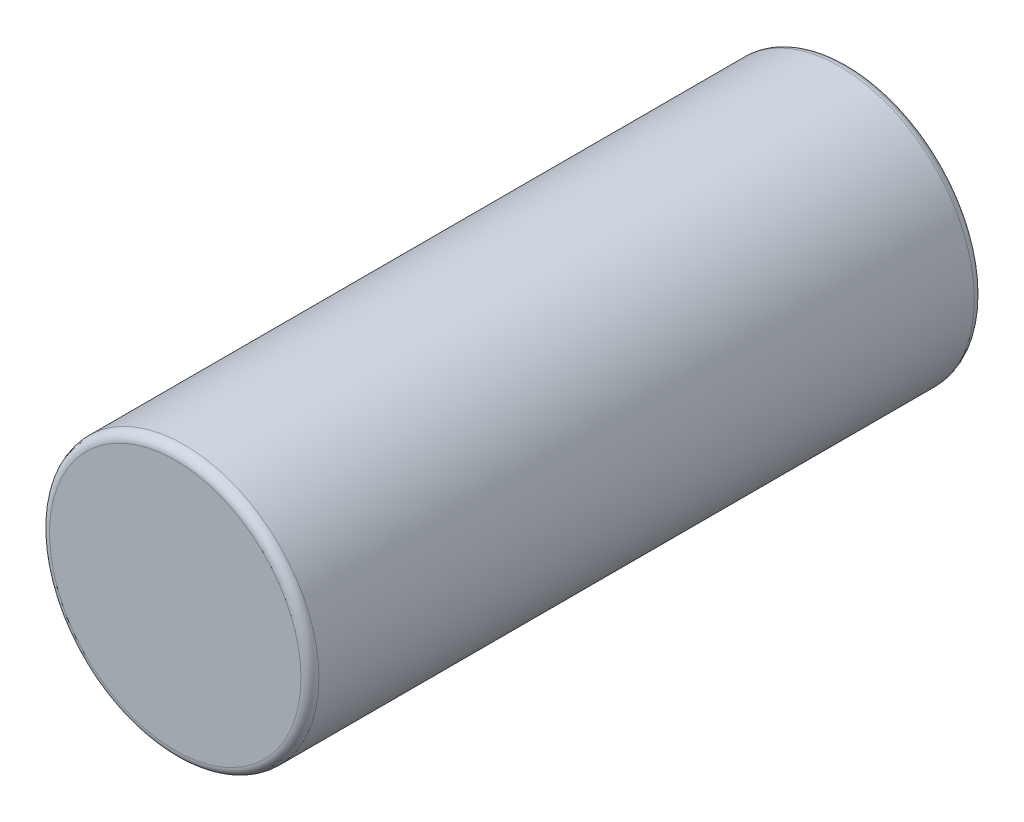
from build123d import *

# Parameters (mm, degrees)
SKETCH_1_R      = 3
EXTRUDE_1_DEPTH = 15
FILLET_1_R      = 0.2


with BuildPart() as part:
    # 스케치1 → 보스-돌출1 (new body)
    with BuildSketch(Plane.XY):
        Circle(SKETCH_1_R)
    extrude(amount=EXTRUDE_1_DEPTH)

    # 필렛1
    fillet_1_edges = [part.edges().sort_by_distance(p)[0] for p in [
        (-3, 0, 0),
        (-3, 0, 15),
    ]]
    fillet(fillet_1_edges, radius=FILLET_1_R)


solid = part.part
